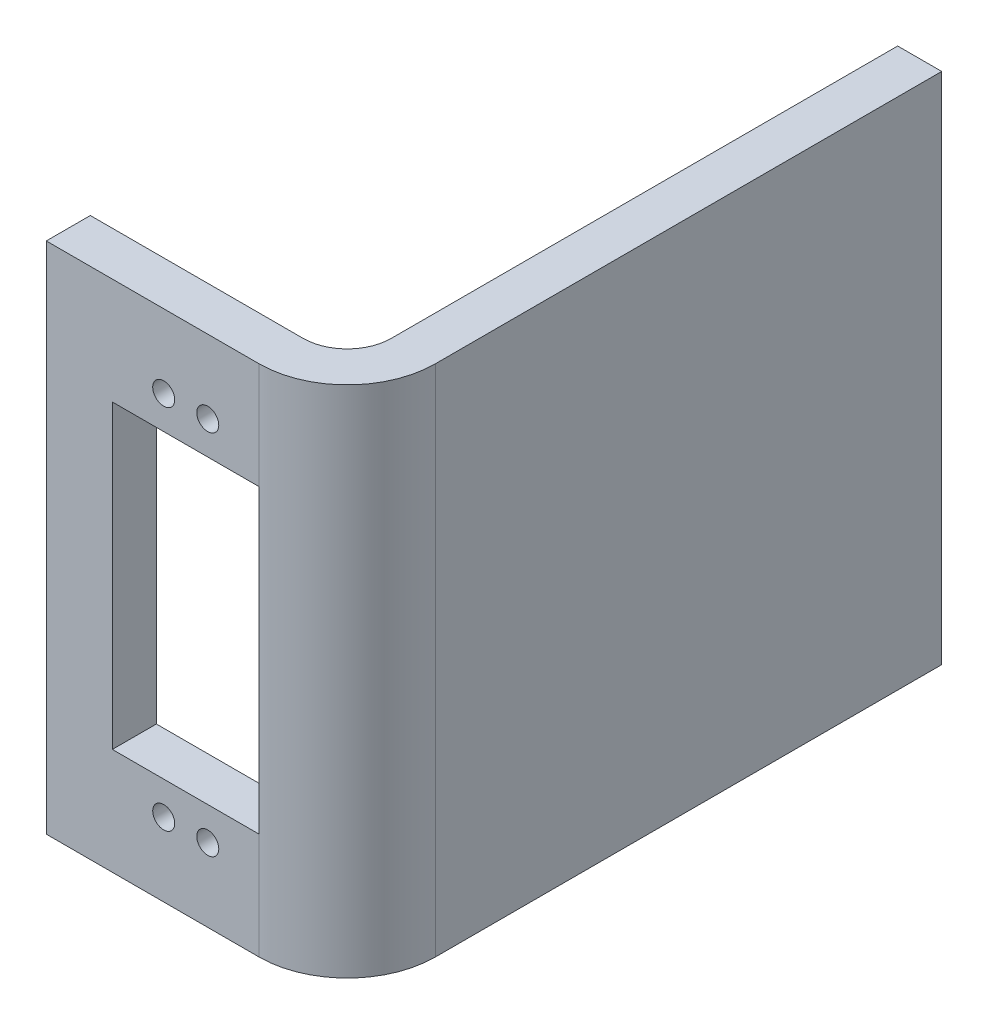
from build123d import *

# Parameters (mm, degrees)
BOSS_EXTRUDE1_DEPTH = 70
SKETCH3_R           = 1.5
SKETCH3_W           = 20
SKETCH3_H           = 41
CUT_EXTRUDE1_DEPTH  = 50


with BuildPart() as part:
    # Sketch2 → Boss-Extrude1 (new body)
    with BuildSketch(Plane(origin=(0, 0, 0), x_dir=(1, 0, 0), z_dir=(0, 1, 0))):
        with BuildLine():
            ThreePointArc((6, -69), (2.485281374, -77.485281374), (-6, -81))
            Line((-6, -81), (-35, -81))
            Line((-35, -81), (-35, -75))
            Line((-35, -75), (-6, -75))
            ThreePointArc((-6, -75), (-1.757359313, -73.242640687), (0, -69))
            Line((0, -69), (0, 0))
            Line((0, 0), (6, 0))
            Line((6, 0), (6, -69))
        make_face()
    extrude(amount=BOSS_EXTRUDE1_DEPTH)

    # Sketch3 → Cut-Extrude1 (cut)
    with BuildSketch(Plane.XY.offset(81)):
        with Locations((-19, 60)):
            Circle(SKETCH3_R)
        with Locations((-13, 60)):
            Circle(SKETCH3_R)
        with Locations((-13, 10)):
            Circle(SKETCH3_R)
        with Locations((-19, 10)):
            Circle(SKETCH3_R)
        with Locations((-16, 35)):
            Rectangle(SKETCH3_W, SKETCH3_H)
    extrude(amount=-CUT_EXTRUDE1_DEPTH, mode=Mode.SUBTRACT)


solid = part.part
